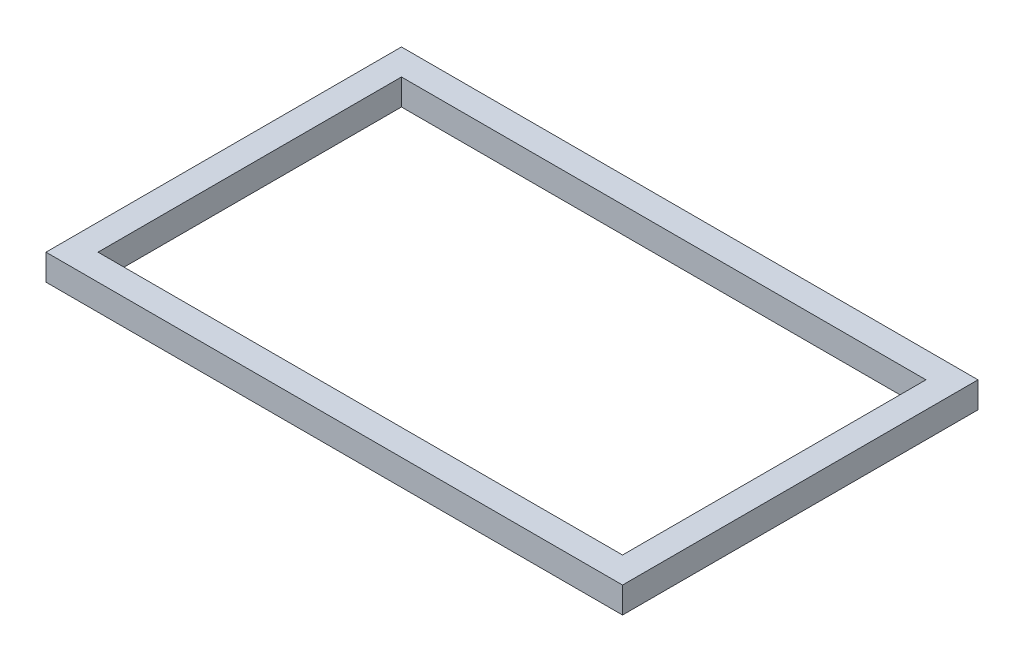
from build123d import *

# Parameters (mm, degrees)
SKETCH1_W           = 399
SKETCH1_H           = 246
SKETCH1_W_2         = 363
SKETCH1_H_2         = 210
BOSS_EXTRUDE1_DEPTH = 18


with BuildPart() as part:
    # Sketch1 → Boss-Extrude1 (new body)
    with BuildSketch(Plane(origin=(0, 0, 0), x_dir=(1, 0, 0), z_dir=(0, 1, 0))):
        with Locations((50.073212119, -24.704144739)):
            Rectangle(SKETCH1_W, SKETCH1_H)
        with Locations((50.073212119, -24.704144739)):
            Rectangle(SKETCH1_W_2, SKETCH1_H_2, mode=Mode.SUBTRACT)
    extrude(amount=BOSS_EXTRUDE1_DEPTH)


solid = part.part
